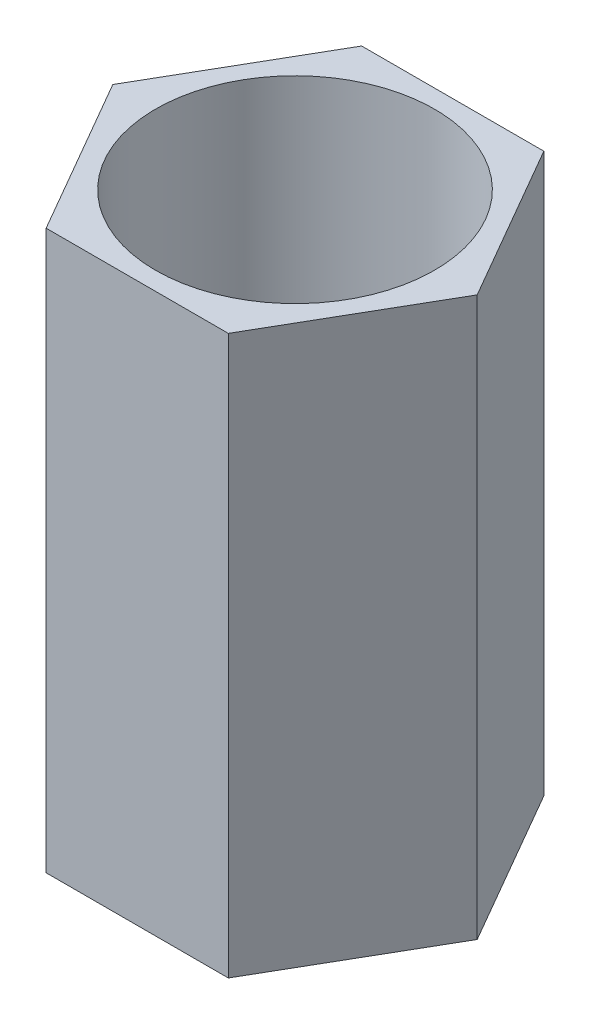
from build123d import *

# Parameters (mm, degrees)
SKETCH1_R           = 1.5
BOSS_EXTRUDE1_DEPTH = 6


with BuildPart() as part:
    # Sketch1 → Boss-Extrude1 (new body)
    with BuildSketch(Plane(origin=(0, 0, 0), x_dir=(1, 0, 0), z_dir=(0, 1, 0))):
        Polygon((0.979018569, -1.695709904), (1.958037139, 0), (0.979018569, 1.695709904), (-0.979018569, 1.695709904), (-1.958037139, 0), (-0.979018569, -1.695709904), align=None)
        with Locations(Location((0, 0, 0), (0, 0, 270))):
            Circle(SKETCH1_R, mode=Mode.SUBTRACT)
    extrude(amount=BOSS_EXTRUDE1_DEPTH)


solid = part.part
